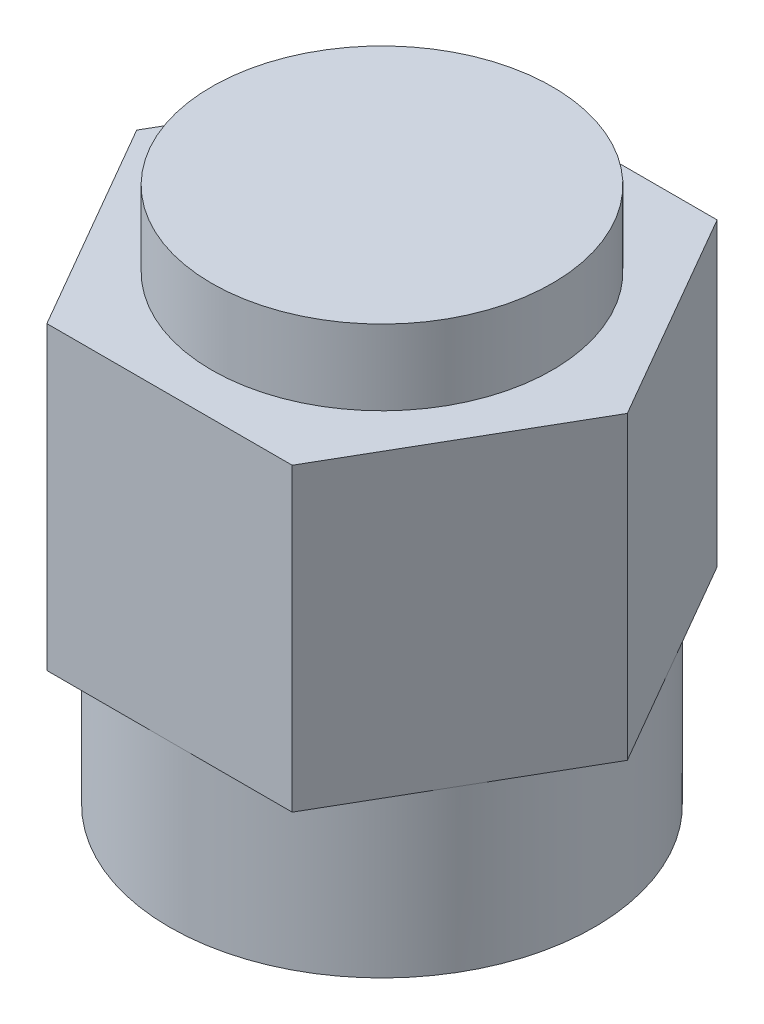
from build123d import *

# Parameters (mm, degrees)
SKETCH5_R           = 3.96
BOSS_EXTRUDE5_DEPTH = 3
BOSS_EXTRUDE7_DEPTH = 5.6
SKETCH7_R           = 3.175
CUT_EXTRUDE1_DEPTH  = 5
SKETCH8_R           = 3.175
BOSS_EXTRUDE9_DEPTH = 1.4


with BuildPart() as part:
    # Sketch5 → Boss-Extrude5 (new body)
    with BuildSketch(Plane(origin=(0, 0, 0), x_dir=(-1, 0, 0), z_dir=(0, 1, 0))):
        with Locations(Location((0, 0, 0), (0, 0, 90))):
            Circle(SKETCH5_R)
    extrude(amount=BOSS_EXTRUDE5_DEPTH)

    # Sketch6 → Boss-Extrude7 (add)
    with BuildSketch(Plane.XZ.offset(-3)):
        Polygon((-4.572614132, 0), (-2.286307066, -3.96), (2.286307066, -3.96), (4.572614132, 0), (2.286307066, 3.96), (-2.286307066, 3.96), align=None)
    extrude(amount=-BOSS_EXTRUDE7_DEPTH)

    # Sketch7 → Cut-Extrude1 (cut)
    with BuildSketch(Plane.XZ):
        with Locations(Location((0, 0, 0), (0, 0, 270))):
            Circle(SKETCH7_R)
    extrude(amount=-CUT_EXTRUDE1_DEPTH, mode=Mode.SUBTRACT)

    # Sketch8 → Boss-Extrude9 (add)
    with BuildSketch(Plane(origin=(0, 8.6, 0), x_dir=(1, 0, 0), z_dir=(0, 1, 0))):
        with Locations(Location((0, 0, 0), (0, 0, 90))):
            Circle(SKETCH8_R)
    extrude(amount=BOSS_EXTRUDE9_DEPTH)


solid = part.part
